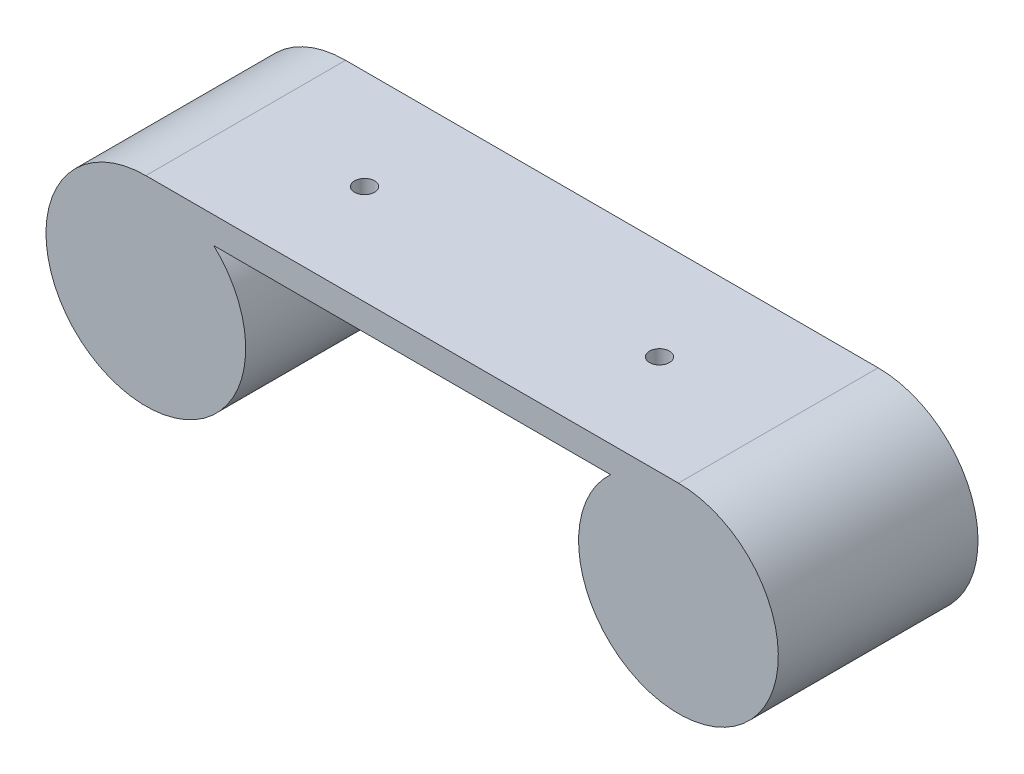
from build123d import *

# Parameters (mm, degrees)
SKETCH1_R           = 5
BOSS_EXTRUDE1_DEPTH = 30
SKETCH3_R           = 1.5
CUT_EXTRUDE1_DEPTH  = 6
SKETCH5_R           = 9.45
BOSS_EXTRUDE2_DEPTH = 2


with BuildPart() as part:
    # Sketch1 → Boss-Extrude1 (new body)
    with BuildSketch(Plane.XY):
        with BuildLine():
            Line((-40, 15), (40, 15))
            ThreePointArc((40, 15), (45.476992863, -13.964331319), (29.802327604, 11.00033989))
            Line((29.802327604, 11.00033989), (-29.802327604, 11.00033989))
            ThreePointArc((-29.802327604, 11.00033989), (-45.476992863, -13.964331319), (-40, 15))
        make_face()
        with Locations((-40, 0)):
            Circle(SKETCH1_R, mode=Mode.SUBTRACT)
        with Locations((40, 0)):
            Circle(SKETCH1_R, mode=Mode.SUBTRACT)
    extrude(amount=BOSS_EXTRUDE1_DEPTH)

    # Sketch3 → Cut-Extrude1 (cut)
    with BuildSketch(Plane(origin=(0, 15, 0), x_dir=(1, 0, 0), z_dir=(0, 1, 0))):
        with Locations(Location((-22.15, -15, 0), (0, 0, 270))):
            Circle(SKETCH3_R)
        with Locations(Location((22.15, -15, 0), (0, 0, 270))):
            Circle(SKETCH3_R)
    extrude(amount=-CUT_EXTRUDE1_DEPTH, mode=Mode.SUBTRACT)

    # Sketch5 → Boss-Extrude2 (add)
    with BuildSketch(Plane.XY.offset(30)):
        with Locations((-40, 0)):
            Circle(SKETCH5_R)
        with Locations((40, 0)):
            Circle(SKETCH5_R)
    extrude(amount=-BOSS_EXTRUDE2_DEPTH)


solid = part.part
